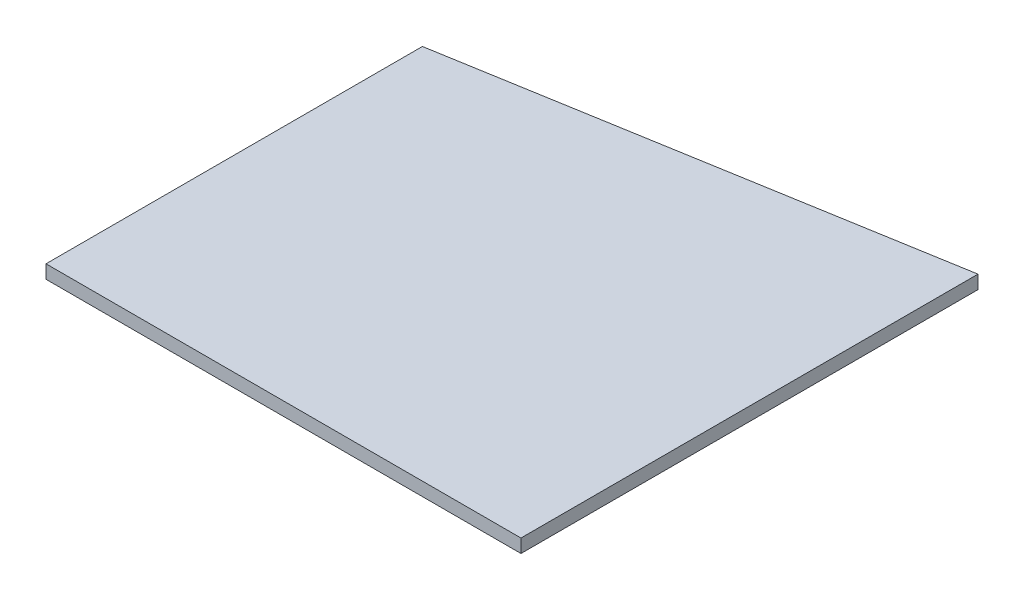
from build123d import *

# Parameters (mm, degrees)
BOSS_EXTRUDE1_DEPTH = 1.5


with BuildPart() as part:
    # Sketch1 → Boss-Extrude1 (new body)
    with BuildSketch(Plane(origin=(0, 0, 0), x_dir=(1, 0, 0), z_dir=(0, 1, 0))):
        Polygon((21.1003861, 24.712355212), (21.1003861, -26.287644788), (-31.8996139, -26.287644788), (-31.8996139, 15.712355212), align=None)
    extrude(amount=BOSS_EXTRUDE1_DEPTH)


solid = part.part
